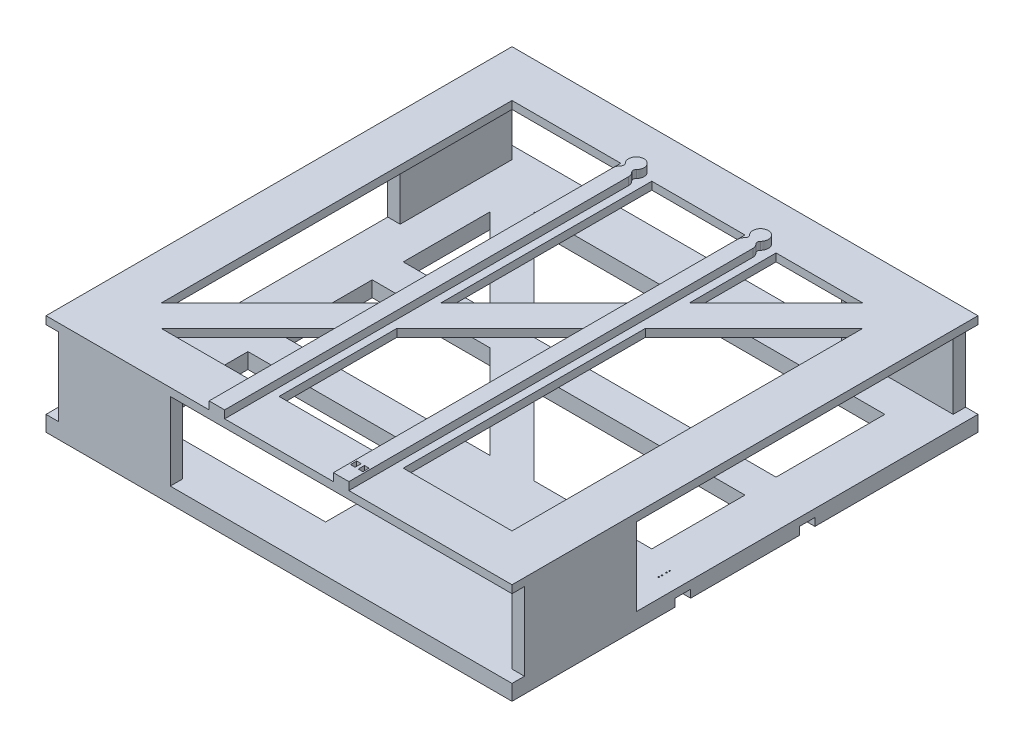
from build123d import *

# Parameters (mm, degrees)
SKETCH_1_W          = 120
SKETCH_1_H          = 70
EXTRUDE_1_DEPTH     = 5
SKETCH_2_W          = 120
SKETCH_2_H          = 70
EXTRUDE_2_DEPTH     = 5
SKETCH_3_W          = 8
SKETCH_3_H          = 72
SKETCH_3_W_2        = 72
SKETCH_3_H_2        = 8
EXTRUDE_3_DEPTH     = 50
SKETCH_4_W          = 300
SKETCH_4_H          = 300
EXTRUDE_4_DEPTH     = 5
EXTRUDE_5_DEPTH     = 5
SKETCH_6_W          = 4
SKETCH_6_H          = 3
CUT_EXTRUDE_1_DEPTH = 3
SKETCH_7_R          = 0.4
CUT_EXTRUDE_2_DEPTH = 3
SKETCH_8_W          = 3
SKETCH_8_H          = 4
CUT_EXTRUDE_3_DEPTH = 3
SKETCH_9_R          = 0.4
CUT_EXTRUDE_4_DEPTH = 3


with BuildPart() as part:
    # 草图1 → 凸台-拉伸1 (new body)
    with BuildSketch(Plane(origin=(0, 0, 0), x_dir=(1, 0, 0), z_dir=(0, 1, 0))):
        Polygon((-150, 150), (150, 150), (150, -30), (150, -150), (0, -150), (-150, -150), align=None)
        Polygon((-15.857864376, 30), (120, 30), (120, -30), (44.142135624, -30), align=None, mode=Mode.SUBTRACT)
        Polygon((-105.857864376, 120), (120, 120), (120, 50), (-35.857864376, 50), align=None, mode=Mode.SUBTRACT)
        Polygon((-120, 105.857864376), (-120, 50), (-64.142135624, 50), align=None, mode=Mode.SUBTRACT)
        with Locations((-60, -85)):
            Rectangle(SKETCH_1_W, SKETCH_1_H, mode=Mode.SUBTRACT)
        Polygon((-120, 30), (-44.142135624, 30), (15.857864376, -30), (-120, -30), align=None, mode=Mode.SUBTRACT)
    extrude(amount=EXTRUDE_1_DEPTH)

    # 草图2 → 凸台-拉伸2 (add)
    with BuildSketch(Plane.XZ):
        with BuildLine():
            Line((150, 45), (150, 150))
            Line((150, 150), (-150, 150))
            Line((-150, 150), (-150, -150))
            Line((-150, -150), (150, -150))
            Line((150, -150), (150, -45))
            Line((150, -45), (-110, -45))
            ThreePointArc((-110, -45), (-111.913417162, -44.619397663), (-113.535533906, -43.535533906))
            ThreePointArc((-113.535533906, -43.535533906), (-115, -42.928932188), (-116.464466094, -43.535533906))
            ThreePointArc((-116.464466094, -43.535533906), (-125, -40), (-116.464466094, -36.464466094))
            ThreePointArc((-116.464466094, -36.464466094), (-115, -37.071067812), (-113.535533906, -36.464466094))
            ThreePointArc((-113.535533906, -36.464466094), (-111.913417162, -35.380602337), (-110, -35))
            Line((-110, -35), (150, -35))
            Line((150, -35), (150, 35))
            Line((150, 35), (-110, 35))
            ThreePointArc((-110, 35), (-111.913417162, 35.380602337), (-113.535533906, 36.464466094))
            ThreePointArc((-113.535533906, 36.464466094), (-115, 37.071067812), (-116.464466094, 36.464466094))
            ThreePointArc((-116.464466094, 36.464466094), (-125, 40), (-116.464466094, 43.535533906))
            ThreePointArc((-116.464466094, 43.535533906), (-115, 42.928932188), (-113.535533906, 43.535533906))
            ThreePointArc((-113.535533906, 43.535533906), (-111.913417162, 44.619397663), (-110, 45))
            Line((-110, 45), (150, 45))
        make_face()
        with Locations((-60, 85)):
            Rectangle(SKETCH_2_W, SKETCH_2_H, mode=Mode.SUBTRACT)
        Polygon((-120, 30), (-120, -30), (-44.142135624, -30), (15.857864376, 30), align=None, mode=Mode.SUBTRACT)
        Polygon((44.142135624, 30), (-15.857864376, -30), (120, -30), (120, 30), align=None, mode=Mode.SUBTRACT)
        Polygon((-120, -50), (-120, -105.857864376), (-64.142135624, -50), align=None, mode=Mode.SUBTRACT)
        Polygon((-35.857864376, -50), (-105.857864376, -120), (120, -120), (120, -50), align=None, mode=Mode.SUBTRACT)
    extrude(amount=EXTRUDE_2_DEPTH)

    # 草图3 → 凸台-拉伸3 (add)
    with BuildSketch(Plane(origin=(0, 5, 0), x_dir=(1, 0, 0), z_dir=(0, 1, 0))):
        with Locations((146, -106)):
            Rectangle(SKETCH_3_W, SKETCH_3_H)
        with Locations((-106, -146)):
            Rectangle(SKETCH_3_W_2, SKETCH_3_H_2)
        with Locations((-146, 106)):
            Rectangle(SKETCH_3_W, SKETCH_3_H)
        with Locations((106, 146)):
            Rectangle(SKETCH_3_W_2, SKETCH_3_H_2)
    extrude(amount=EXTRUDE_3_DEPTH)

    # 草图4 → 凸台-拉伸4 (add)
    with BuildSketch(Plane(origin=(0, 55, 0), x_dir=(1, 0, 0), z_dir=(0, 1, 0))):
        Rectangle(SKETCH_4_W, SKETCH_4_H)
        Polygon((30, 120), (-30, 120), (-30, -15.857864376), (30, 44.142135624), align=None, mode=Mode.SUBTRACT)
        Polygon((105.857864376, 120), (50, 120), (50, 64.142135624), align=None, mode=Mode.SUBTRACT)
        Polygon((120, 105.857864376), (120, -120), (50, -120), (50, 35.857864376), align=None, mode=Mode.SUBTRACT)
        Polygon((-120, 120), (-120, -105.857864376), (-50, -35.857864376), (-50, 120), align=None, mode=Mode.SUBTRACT)
        Polygon((-50, -120), (-105.857864376, -120), (-50, -64.142135624), align=None, mode=Mode.SUBTRACT)
        Polygon((30, -120), (-30, -120), (-30, -44.142135624), (30, 15.857864376), align=None, mode=Mode.SUBTRACT)
    extrude(amount=EXTRUDE_4_DEPTH)

    # 草图5 → 凸台-拉伸5 (add)
    with BuildSketch(Plane(origin=(0, 60, 0), x_dir=(1, 0, 0), z_dir=(0, 1, 0))):
        with BuildLine():
            Line((35, 110), (35, -150))
            Line((35, -150), (45, -150))
            Line((45, -150), (45, 110))
            ThreePointArc((45, 110), (44.619397663, 111.913417162), (43.535533906, 113.535533906))
            ThreePointArc((43.535533906, 113.535533906), (42.928932188, 115), (43.535533906, 116.464466094))
            ThreePointArc((43.535533906, 116.464466094), (40, 125), (36.464466094, 116.464466094))
            ThreePointArc((36.464466094, 116.464466094), (37.071067812, 115), (36.464466094, 113.535533906))
            ThreePointArc((36.464466094, 113.535533906), (35.380602337, 111.913417162), (35, 110))
        make_face()
        with BuildLine():
            Line((-45, -150), (-35, -150))
            Line((-35, -150), (-35, 110))
            ThreePointArc((-35, 110), (-35.380602337, 111.913417162), (-36.464466094, 113.535533906))
            ThreePointArc((-36.464466094, 113.535533906), (-37.071067812, 115), (-36.464466094, 116.464466094))
            ThreePointArc((-36.464466094, 116.464466094), (-40, 125), (-43.535533906, 116.464466094))
            ThreePointArc((-43.535533906, 116.464466094), (-42.928932188, 115), (-43.535533906, 113.535533906))
            ThreePointArc((-43.535533906, 113.535533906), (-44.619397663, 111.913417162), (-45, 110))
            Line((-45, 110), (-45, -150))
        make_face()
    extrude(amount=EXTRUDE_5_DEPTH)

    # 草图6 → 切除-拉伸1 (cut)
    with BuildSketch(Plane.XZ):
        with Locations((138, 42.5)):
            Rectangle(SKETCH_6_W, SKETCH_6_H)
        with Locations((138, 37.5)):
            Rectangle(SKETCH_6_W, SKETCH_6_H)
    extrude(amount=-CUT_EXTRUDE_1_DEPTH, mode=Mode.SUBTRACT)

    # 草图7 → 切除-拉伸2 (cut)
    with BuildSketch(Plane.XZ.offset(-3)):
        with Locations(Location((138, 43.5, 0), (0, 0, 270))):
            Circle(SKETCH_7_R)
        with Locations(Location((138, 41.5, 0), (0, 0, 90))):
            Circle(SKETCH_7_R)
        with Locations(Location((138, 36.5, 0), (0, 0, 90))):
            Circle(SKETCH_7_R)
        with Locations(Location((138, 38.5, 0), (0, 0, 270))):
            Circle(SKETCH_7_R)
    extrude(amount=-CUT_EXTRUDE_2_DEPTH, mode=Mode.SUBTRACT)

    # 草图8 → 切除-拉伸3 (cut)
    with BuildSketch(Plane(origin=(0, 65, 0), x_dir=(1, 0, 0), z_dir=(0, 1, 0))):
        with Locations((37.5, -138)):
            Rectangle(SKETCH_8_W, SKETCH_8_H)
        with Locations((42.5, -138)):
            Rectangle(SKETCH_8_W, SKETCH_8_H)
    extrude(amount=-CUT_EXTRUDE_3_DEPTH, mode=Mode.SUBTRACT)

    # 草图9 → 切除-拉伸4 (cut)
    with BuildSketch(Plane(origin=(0, 62, 0), x_dir=(1, 0, 0), z_dir=(0, 1, 0))):
        with Locations(Location((43.5, -138, 0), (0, 0, 270))):
            Circle(SKETCH_9_R)
        with Locations(Location((41.5, -138, 0), (0, 0, 270))):
            Circle(SKETCH_9_R)
        with Locations(Location((36.5, -138, 0), (0, 0, 90))):
            Circle(SKETCH_9_R)
        with Locations(Location((38.5, -138, 0), (0, 0, 90))):
            Circle(SKETCH_9_R)
    extrude(amount=-CUT_EXTRUDE_4_DEPTH, mode=Mode.SUBTRACT)


solid = part.part
